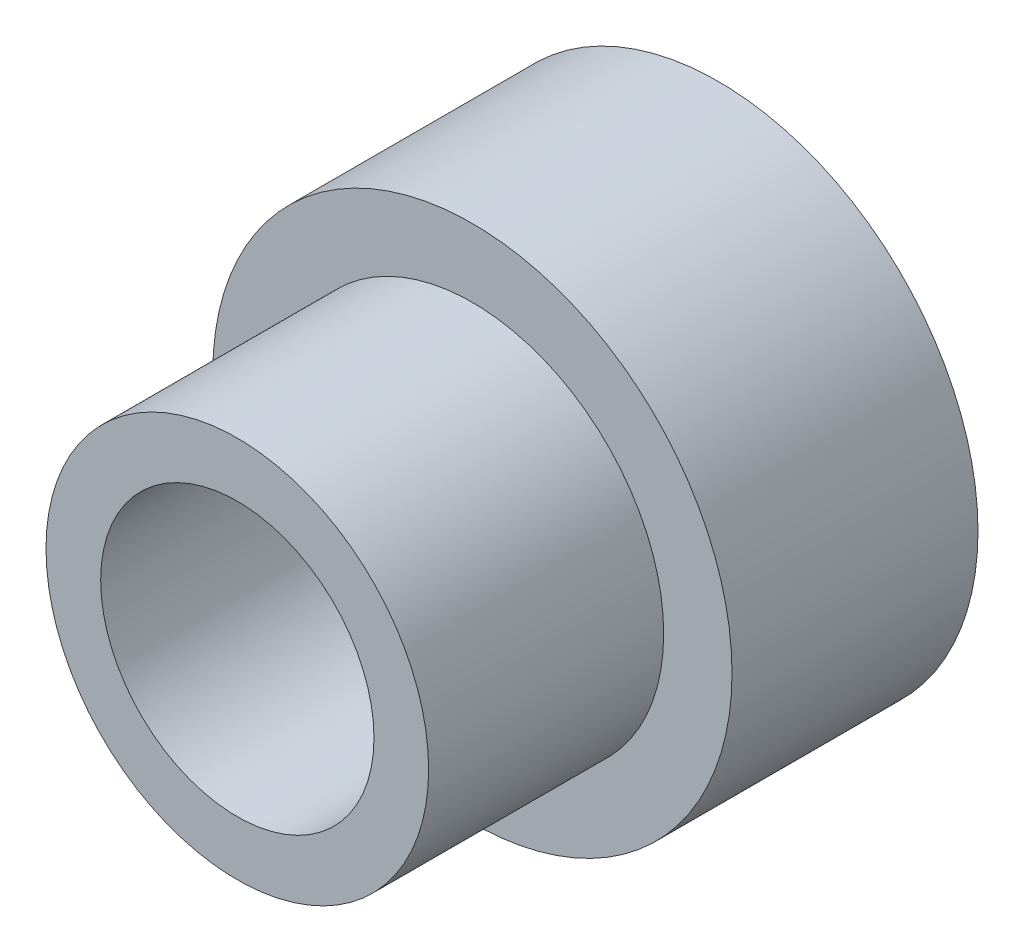
from build123d import *

# Parameters (mm, degrees)
ESQUISSE1_R             = 4.75
BOSS_EXTRU_1_DEPTH      = 8.8
ENL_V_START             = -4.3
ESQUISSE2_R             = 4.75
ESQUISSE2_R_2           = 3.5
ENL_V_MAT_EXTRU_1_DEPTH = 4.3
ESQUISSE3_R             = 2.5
ENL_V_MAT_EXTRU_2_DEPTH = 12.070907822
ESQUISSE5_R             = 1.25
ENL_V_MAT_EXTRU_3_DEPTH = 5


with BuildPart() as part:
    # Esquisse1 → Boss.-Extru.1 (new body)
    with BuildSketch(Plane.XY):
        Circle(ESQUISSE1_R)
    extrude(amount=BOSS_EXTRU_1_DEPTH)

    # Esquisse2 → Enlèv. mat.-Extru.1 (cut)
    with BuildSketch(Plane.XY.offset(8.8).offset(ENL_V_START)):
        Circle(ESQUISSE2_R)
        Circle(ESQUISSE2_R_2, mode=Mode.SUBTRACT)
    extrude(amount=ENL_V_MAT_EXTRU_1_DEPTH, mode=Mode.SUBTRACT)

    # Esquisse3 → Enlèv. mat.-Extru.2 (cut, through all)
    with BuildSketch(Plane(origin=(0, 0, 0), x_dir=(-1, 0, 0), z_dir=(0, 0, -1))):
        Circle(ESQUISSE3_R)
    extrude(amount=-ENL_V_MAT_EXTRU_2_DEPTH, mode=Mode.SUBTRACT)

    # Esquisse5 → Enlèv. mat.-Extru.3 (cut)
    with BuildSketch(Plane(origin=(-4.749906239, 0.029844934, 2.25), x_dir=(0, 0, 1), z_dir=(-0.9999802608561372, 0.006283143965558953, 0))):
        with Locations(Location((0, 0, 0), (0, 0, 358.631878995))):
            Circle(ESQUISSE5_R)
    extrude(amount=-ENL_V_MAT_EXTRU_3_DEPTH, mode=Mode.SUBTRACT)


solid = part.part
